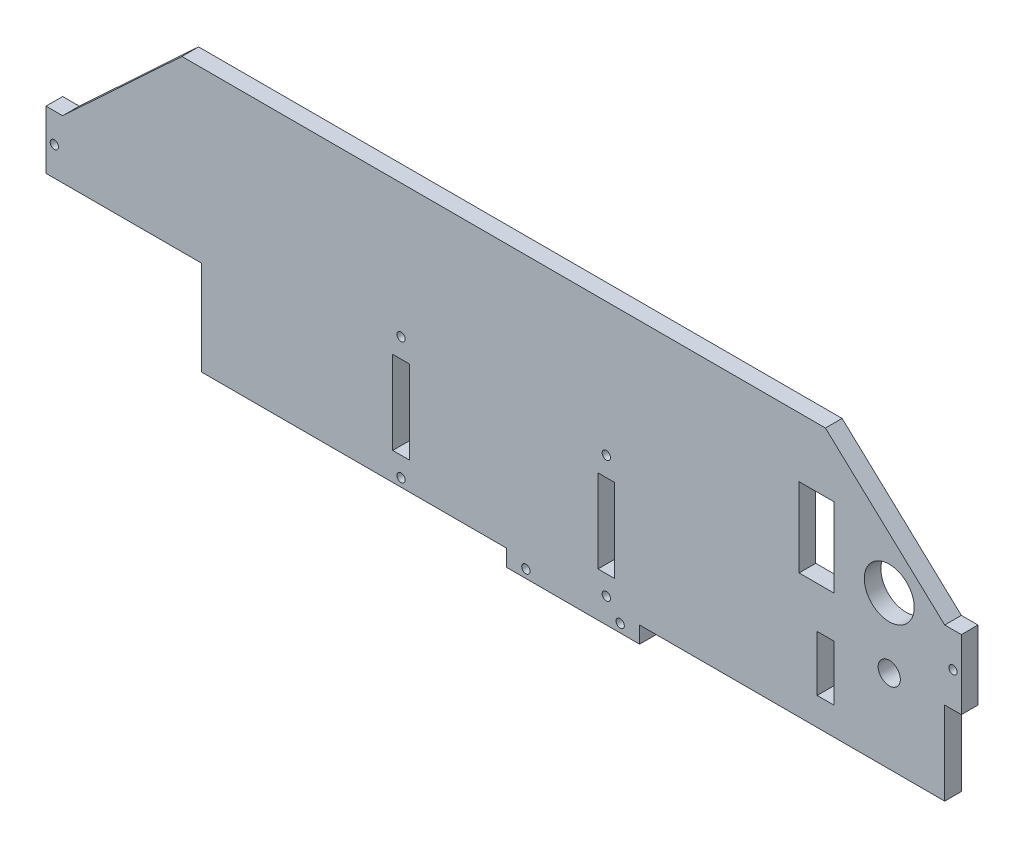
from build123d import *

# Parameters (mm, degrees)
BOSS_EXTRU_1_DEPTH      = 6
ESQUISSE2_R             = 4
ESQUISSE2_R_2           = 9
ESQUISSE2_W             = 6
ESQUISSE2_H             = 30
ESQUISSE2_H_2           = 20
ESQUISSE2_W_2           = 12.5
ESQUISSE2_H_3           = 28.5
ENL_V_MAT_EXTRU_1_DEPTH = 6
ESQUISSE3_R             = 1.5
ENL_V_MAT_EXTRU_2_DEPTH = 6
ESQUISSE4_R             = 2.995
ESQUISSE4_R_2           = 3
ENL_V_MAT_EXTRU_3_DEPTH = 3


with BuildPart() as part:
    # Esquisse1 → Boss.-Extru.1 (new body)
    with BuildSketch(Plane.XY):
        Polygon((0, 0), (48, 0), (48, 6), (158, 6), (158, 36), (164, 36), (164, 61), (158, 61), (115, 101.002661161), (-117, 101.002661161), (-160, 61), (-166, 61), (-166, 40), (-110, 40), (-110, 6), (0, 6), align=None)
    extrude(amount=BOSS_EXTRU_1_DEPTH)

    # Esquisse2 → Enlèv. mat.-Extru.1 (cut)
    with BuildSketch(Plane(origin=(0, 0, 0), x_dir=(-1, 0, 0), z_dir=(0, 0, -1))):
        with Locations((-138, 36)):
            Circle(ESQUISSE2_R)
        with Locations((-138, 61)):
            Circle(ESQUISSE2_R_2)
        with Locations((38, 31)):
            Rectangle(ESQUISSE2_W, ESQUISSE2_H)
        with Locations((-36, 31)):
            Rectangle(ESQUISSE2_W, ESQUISSE2_H)
        with Locations((-115, 26)):
            Rectangle(ESQUISSE2_W, ESQUISSE2_H_2)
        with Locations((-111.75, 65.25)):
            Rectangle(ESQUISSE2_W_2, ESQUISSE2_H_3)
    extrude(amount=-ENL_V_MAT_EXTRU_1_DEPTH, mode=Mode.SUBTRACT)

    # Esquisse3 → Enlèv. mat.-Extru.2 (cut)
    with BuildSketch(Plane(origin=(0, 0, 0), x_dir=(-1, 0, 0), z_dir=(0, 0, -1))):
        with Locations((-161, 48.5)):
            Circle(ESQUISSE3_R)
        with Locations((-41, 3)):
            Circle(ESQUISSE3_R)
        with Locations((-7, 3)):
            Circle(ESQUISSE3_R)
        with Locations((-36, 9)):
            Circle(ESQUISSE3_R)
        with Locations((-36, 53)):
            Circle(ESQUISSE3_R)
        with Locations((38, 9)):
            Circle(ESQUISSE3_R)
        with Locations((38, 53)):
            Circle(ESQUISSE3_R)
        with Locations((163, 50.5)):
            Circle(ESQUISSE3_R)
    extrude(amount=-ENL_V_MAT_EXTRU_2_DEPTH, mode=Mode.SUBTRACT)

    # Esquisse4 → Enlèv. mat.-Extru.3 (cut)
    with BuildSketch(Plane(origin=(0, 0, 0), x_dir=(-1, 0, 0), z_dir=(0, 0, -1))):
        with Locations((38, 9)):
            Circle(ESQUISSE4_R)
        with Locations((38, 53)):
            Circle(ESQUISSE4_R_2)
        with Locations((-36, 53)):
            Circle(ESQUISSE4_R_2)
        with Locations((-36, 9)):
            Circle(ESQUISSE4_R_2)
        with Locations((-7, 3)):
            Circle(ESQUISSE4_R)
        with Locations((-41, 3)):
            Circle(ESQUISSE4_R)
        with Locations((-161, 48.5)):
            Circle(ESQUISSE4_R)
        with Locations((163, 50.5)):
            Circle(ESQUISSE4_R)
    extrude(amount=-ENL_V_MAT_EXTRU_3_DEPTH, mode=Mode.SUBTRACT)


solid = part.part
